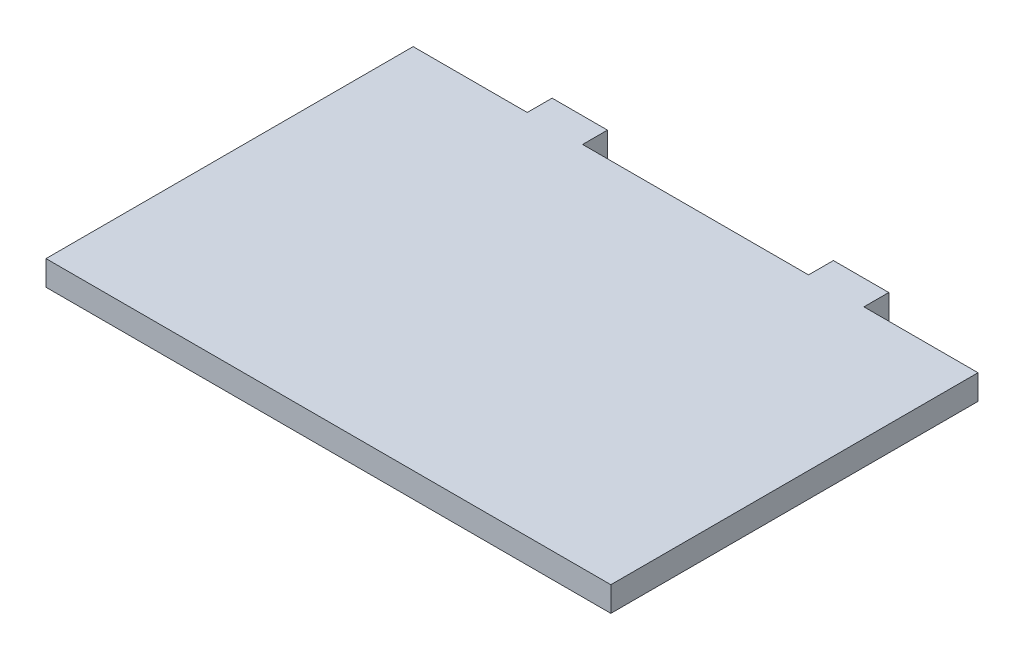
from build123d import *

# Parameters (mm, degrees)
BOSS_EXTRUDE1_DEPTH = 5.588


with BuildPart() as part:
    # Sketch1 → Boss-Extrude1 (new body)
    with BuildSketch(Plane(origin=(0, 0, 0), x_dir=(1, 0, 0), z_dir=(0, 1, 0))):
        Polygon((-63.5, -41.275), (63.5, -41.275), (63.5, 41.275), (37.846, 41.275), (37.846, 46.863), (25.4, 46.863), (25.4, 41.275), (-25.4, 41.275), (-25.4, 46.863), (-37.846, 46.863), (-37.846, 41.275), (-63.5, 41.275), align=None)
    extrude(amount=BOSS_EXTRUDE1_DEPTH)


solid = part.part
